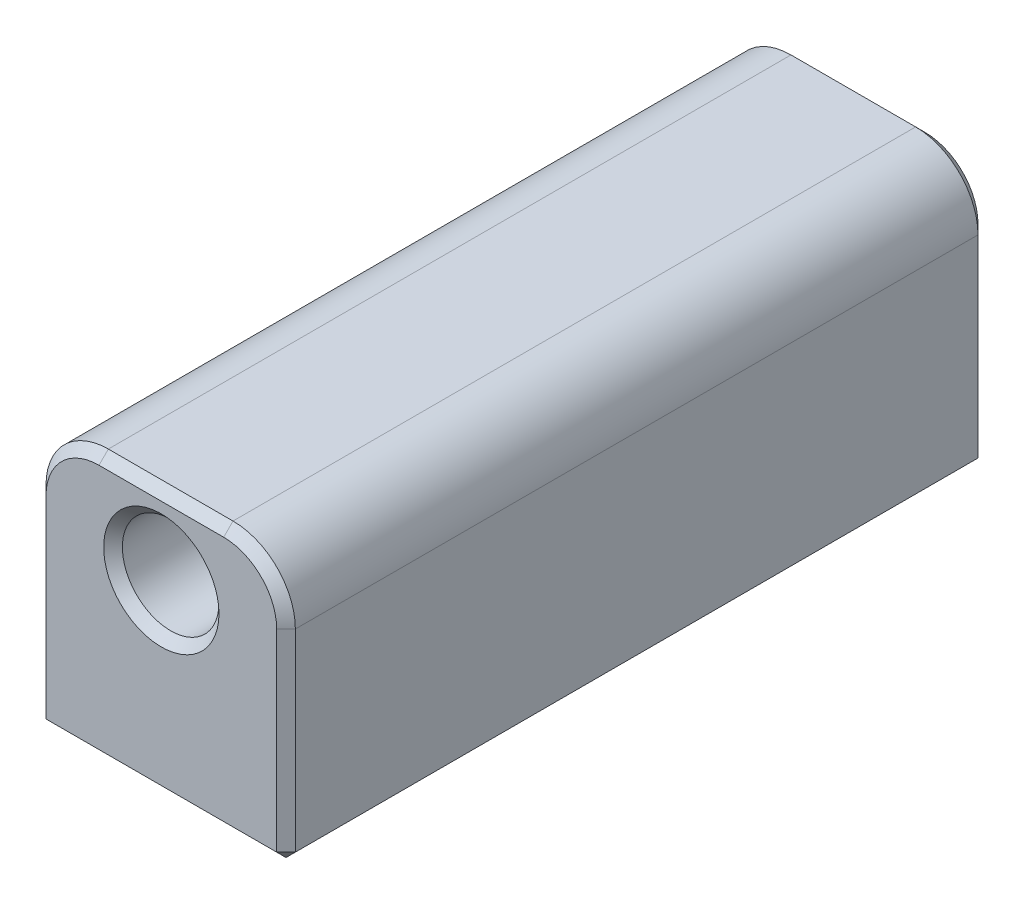
from build123d import *

# Parameters (mm, degrees)
SKETCH1_W           = 10.16
SKETCH1_H           = 28.575
BOSS_EXTRUDE1_DEPTH = 10.795
SKETCH1_6_R         = 2.032
CUT_EXTRUDE3_DEPTH  = 5.08
SKETCH3_R           = 1.9685
CUT_EXTRUDE4_DEPTH  = 31.965610764
FILLET1_R           = 2.54
CHAMFER2_SIZE       = 0.381


with BuildPart() as part:
    # Sketch1 → Boss-Extrude1 (new body)
    with BuildSketch(Plane(origin=(0, 0, 0), x_dir=(1, 0, 0), z_dir=(0, 1, 0))):
        Rectangle(SKETCH1_W, SKETCH1_H)
    extrude(amount=BOSS_EXTRUDE1_DEPTH)

    # Sketch1<6> → Cut-Extrude3 (cut)
    with BuildSketch(Plane(origin=(0, 0, 0), x_dir=(1, 0, 0), z_dir=(0, 1, 0))):
        with Locations((0, 6.35)):
            Circle(SKETCH1_6_R)
        with Locations((0, -6.35)):
            Circle(SKETCH1_6_R)
    extrude(amount=CUT_EXTRUDE3_DEPTH, mode=Mode.SUBTRACT)

    # Sketch3 → Cut-Extrude4 (cut, through all)
    with BuildSketch(Plane.XY.offset(14.2875)):
        with Locations((0, 7.62)):
            Circle(SKETCH3_R)
    extrude(amount=-CUT_EXTRUDE4_DEPTH, mode=Mode.SUBTRACT)

    # Fillet1
    fillet1_edges = [part.edges().sort_by_distance(p)[0] for p in [
        (5.08, 10.795, 0),
        (-5.08, 10.795, 0),
    ]]
    fillet(fillet1_edges, radius=FILLET1_R)

    # Chamfer2
    chamfer2_edges = [part.edges().sort_by_distance(p)[0] for p in [
        (-5.08, 4.1275, -14.2875),
        (5.08, 4.1275, -14.2875),
        (-5.08, 4.1275, 14.2875),
        (5.08, 4.1275, 14.2875),
        (-4.336051224, 10.051051224, -14.2875),
        (0, 10.795, -14.2875),
        (4.336051224, 10.051051224, -14.2875),
        (-4.336051224, 10.051051224, 14.2875),
        (0, 10.795, 14.2875),
        (4.336051224, 10.051051224, 14.2875),
        (-2.032, 0, -6.35),
        (-2.032, 0, 6.35),
        (-1.9685, 7.62, 14.2875),
        (-1.9685, 7.62, -14.2875),
        (0, 0, 14.2875),
        (-5.08, 0, 0),
        (0, 0, -14.2875),
        (5.08, 0, 0),
    ]]
    chamfer(chamfer2_edges, length=CHAMFER2_SIZE)


solid = part.part
